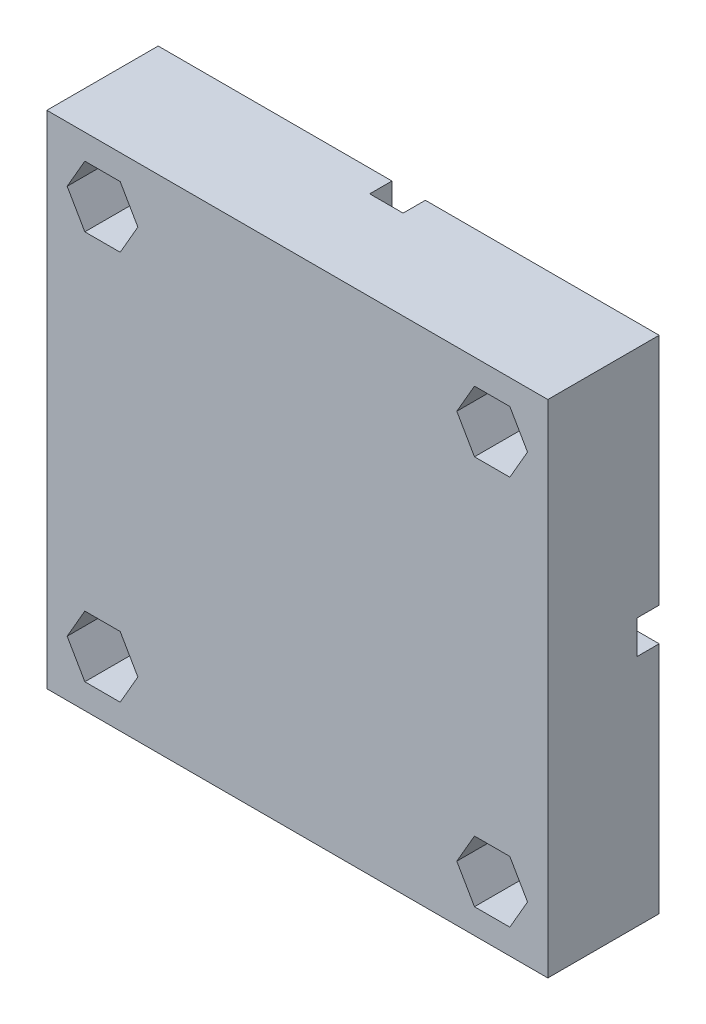
from build123d import *

# Parameters (mm, degrees)
SKETCH1_W           = 45
SKETCH1_H           = 45
SKETCH1_R           = 1.6
BOSS_EXTRUDE1_DEPTH = 10
CUT_EXTRUDE1_DEPTH  = 5
CUT_EXTRUDE2_DEPTH  = 2


with BuildPart() as part:
    # Sketch1 → Boss-Extrude1 (new body)
    with BuildSketch(Plane.XY):
        with Locations((22.5, 22.5)):
            Rectangle(SKETCH1_W, SKETCH1_H)
        with Locations((5, 5)):
            Circle(SKETCH1_R, mode=Mode.SUBTRACT)
        with Locations((5, 40)):
            Circle(SKETCH1_R, mode=Mode.SUBTRACT)
        with Locations((40, 40)):
            Circle(SKETCH1_R, mode=Mode.SUBTRACT)
        with Locations((40, 5)):
            Circle(SKETCH1_R, mode=Mode.SUBTRACT)
    extrude(amount=BOSS_EXTRUDE1_DEPTH)

    # Sketch2 → Cut-Extrude1 (cut)
    with BuildSketch(Plane.XY.offset(10)):
        Polygon((8.175426481, 5), (6.58771324, 7.75), (3.41228676, 7.75), (1.824573519, 5), (3.41228676, 2.25), (6.58771324, 2.25), align=None)
        Polygon((8.175426481, 40), (6.58771324, 42.75), (3.41228676, 42.75), (1.824573519, 40), (3.41228676, 37.25), (6.58771324, 37.25), align=None)
        Polygon((43.175426481, 40), (41.58771324, 42.75), (38.41228676, 42.75), (36.824573519, 40), (38.41228676, 37.25), (41.58771324, 37.25), align=None)
        Polygon((43.175426481, 5), (41.58771324, 7.75), (38.41228676, 7.75), (36.824573519, 5), (38.41228676, 2.25), (41.58771324, 2.25), align=None)
    extrude(amount=-CUT_EXTRUDE1_DEPTH, mode=Mode.SUBTRACT)

    # Sketch3 → Cut-Extrude2 (cut)
    with BuildSketch(Plane(origin=(0, 0, 0), x_dir=(-1, 0, 0), z_dir=(0, 0, -1))):
        Polygon((-45, 24), (-24, 24), (-24, 45), (-21, 45), (-21, 24), (0, 24), (0, 21), (-21, 21), (-21, 0), (-24, 0), (-24, 21), (-45, 21), align=None)
    extrude(amount=-CUT_EXTRUDE2_DEPTH, mode=Mode.SUBTRACT)


solid = part.part
